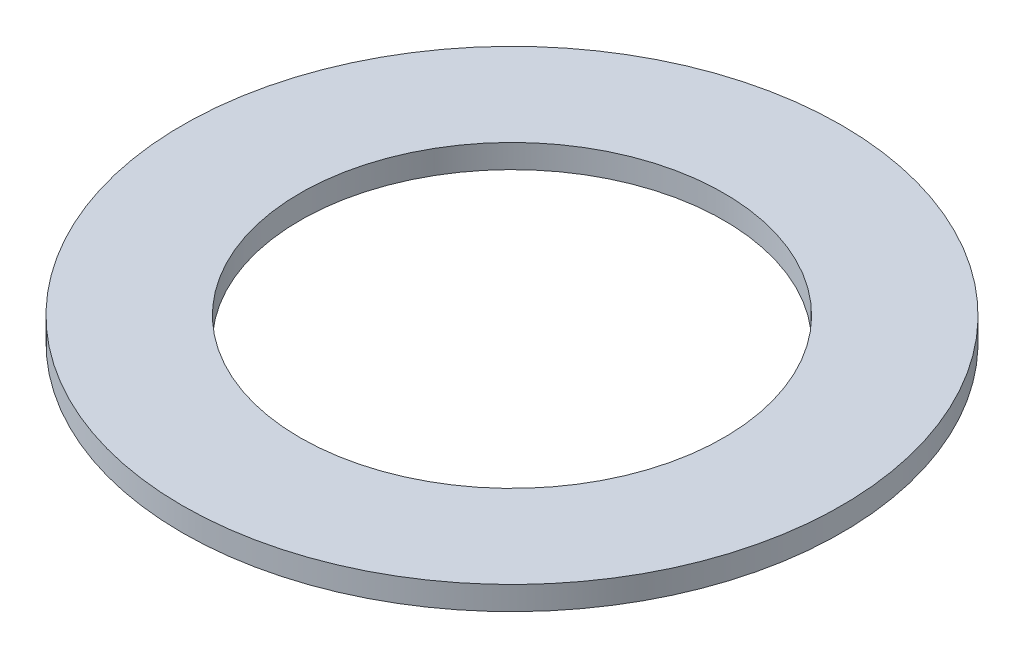
from build123d import *

# Parameters (mm, degrees)
SKETCH1_R           = 7
SKETCH1_R_2         = 4.5
BOSS_EXTRUDE1_DEPTH = 0.5


with BuildPart() as part:
    # Sketch1 → Boss-Extrude1 (new body)
    with BuildSketch(Plane(origin=(0, 0, 0), x_dir=(1, 0, 0), z_dir=(0, 1, 0))):
        with Locations(Location((0, 0, 0), (0, 0, 270))):
            Circle(SKETCH1_R)
        with Locations(Location((0, 0, 0), (0, 0, 270))):
            Circle(SKETCH1_R_2, mode=Mode.SUBTRACT)
    extrude(amount=BOSS_EXTRUDE1_DEPTH)


solid = part.part
